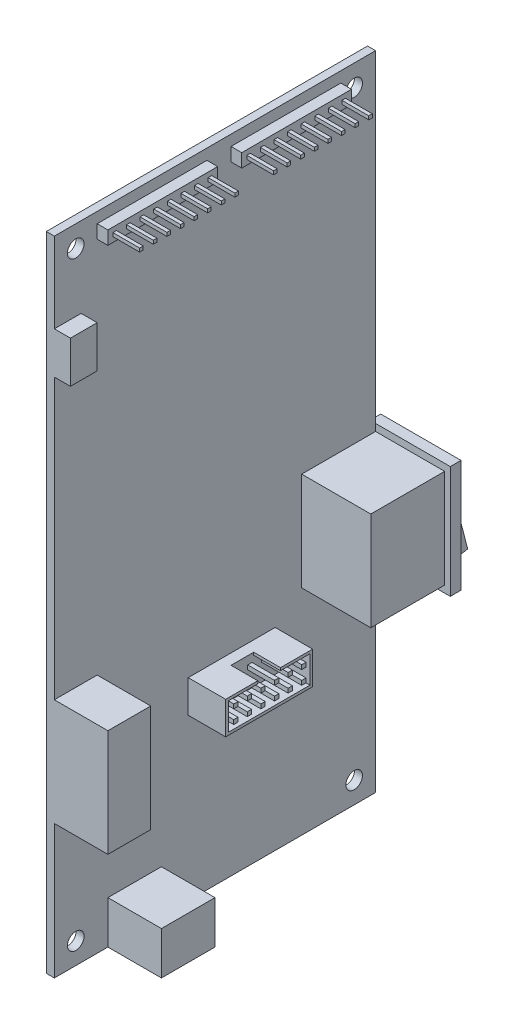
from build123d import *

# Parameters (mm, degrees)
SZKIC3_W                      = 60
SZKIC3_H                      = 120
DODANIE_WYCI_GNI_CIE1_DEPTH   = 1.5
SZKIC4_W                      = 20.5
SZKIC4_H                      = 2.5
DODANIE_WYCI_GNI_CIE2_DEPTH   = 2
SZKIC5_W                      = 0.66
SZKIC5_H                      = 0.66
DODANIE_WYCI_GNI_CIE3_DEPTH   = 5
SZYK_LINIOWY1_COUNT           = 8
SZYK_LINIOWY1_PITCH           = 2.54
SZKIC6_W                      = 16.24
SZKIC6_H                      = 6.08
DODANIE_WYCI_GNI_CIE4_DEPTH   = 2
SZKIC7_W                      = 0.8
SZKIC7_H                      = 0.8
DODANIE_WYCI_GNI_CIE5_DEPTH   = 5
SZYK_LINIOWY2_COUNT           = 6
SZYK_LINIOWY2_PITCH           = 2.54
SZYK_LINIOWY2_COUNT_DIR2      = 2
SZYK_LINIOWY2_PITCH_DIR2      = 2.54
DODANIE_WYCI_GNI_CIE6_DEPTH   = 5
SZKIC9_W                      = 10
SZKIC9_H                      = 8
DODANIE_WYCI_GNI_CIE7_DEPTH   = 10
SZKIC10_W                     = 8
SZKIC10_H                     = 20
DODANIE_WYCI_GNI_CIE8_DEPTH   = 10
SZKIC11_R                     = 1.55
WYTNIJ_WYCI_GNI_CIE2_DEPTH    = 10
SZYK_LINIOWY3_COUNT           = 2
SZYK_LINIOWY3_PITCH           = 52
SZYK_LINIOWY3_COUNT_DIR2      = 2
SZYK_LINIOWY3_PITCH_DIR2      = 112
SZKIC12_W                     = 5
SZKIC12_H                     = 7.8
DODANIE_WYCI_GNI_CIE9_DEPTH   = 3
DODANIE_WYCI_GNI_CIE11_DEPTH  = 12.9
SZYK_LINIOWY7_COUNT           = 2
SZYK_LINIOWY7_PITCH           = 25
SZYK_LINIOWY7_COPY_1_SKETCH_W = 0.66
SZYK_LINIOWY7_COPY_1_SKETCH_H = 0.66
SZYK_LINIOWY7_COPY_1_DEPTH    = 5
SZYK_LINIOWY7_COPY_2_SKETCH_W = 0.66
SZYK_LINIOWY7_COPY_2_SKETCH_H = 0.66
SZYK_LINIOWY7_COPY_2_DEPTH    = 5
SZYK_LINIOWY7_COPY_3_SKETCH_W = 0.66
SZYK_LINIOWY7_COPY_3_SKETCH_H = 0.66
SZYK_LINIOWY7_COPY_3_DEPTH    = 5
SZYK_LINIOWY7_COPY_4_SKETCH_W = 0.66
SZYK_LINIOWY7_COPY_4_SKETCH_H = 0.66
SZYK_LINIOWY7_COPY_4_DEPTH    = 5
SZYK_LINIOWY7_COPY_5_SKETCH_W = 0.66
SZYK_LINIOWY7_COPY_5_SKETCH_H = 0.66
SZYK_LINIOWY7_COPY_5_DEPTH    = 5
SZYK_LINIOWY7_COPY_6_SKETCH_W = 0.66
SZYK_LINIOWY7_COPY_6_SKETCH_H = 0.66
SZYK_LINIOWY7_COPY_6_DEPTH    = 5
SZYK_LINIOWY7_COPY_7_SKETCH_W = 0.66
SZYK_LINIOWY7_COPY_7_SKETCH_H = 0.66
SZYK_LINIOWY7_COPY_7_DEPTH    = 5
SZKIC14_W                     = 2
SZKIC14_H                     = 21
DODANIE_WYCI_GNI_CIE12_DEPTH  = 1.05
SZKIC15_W                     = 2
SZKIC15_H                     = 21
DODANIE_WYCI_GNI_CIE13_DEPTH  = 1.05
DODANIE_WYCI_GNI_CIE14_DEPTH  = 11.3
WYTNIJ_WYCI_GNI_CIE3_DEPTH    = 1.5


with BuildPart() as part:
    # Szkic3 → Dodanie-wyciągnięcie1 (new body)
    with BuildSketch(Plane.ZY.offset(-407.151296802)):
        with Locations((872.359296649, 154.240941848)):
            Rectangle(SZKIC3_W, SZKIC3_H)
    extrude(amount=DODANIE_WYCI_GNI_CIE1_DEPTH)

    # Szkic4 → Dodanie-wyciągnięcie2 (add)
    with BuildSketch(Plane(origin=(407.151296802, 0, 0), x_dir=(0, 0, -1), z_dir=(1, 0, 0))):
        with Locations((-884.109296649, 210.990941848)):
            Rectangle(SZKIC4_W, SZKIC4_H)
    dodanie_wyci_gni_cie2 = extrude(amount=DODANIE_WYCI_GNI_CIE2_DEPTH)

    # Szkic5 → Dodanie-wyciągnięcie3 (add)
    with BuildSketch(Plane(origin=(409.151296802, 0, 0), x_dir=(0, 0, -1), z_dir=(1, 0, 0))):
        with Locations((-893.089296649, 211.010941848)):
            Rectangle(SZKIC5_W, SZKIC5_H)
    dodanie_wyci_gni_cie3 = extrude(amount=DODANIE_WYCI_GNI_CIE3_DEPTH)

    # Szyk liniowy1: Dodanie-wyciągnięcie3 ×8
    with Locations(*[(0, 0, -i * SZYK_LINIOWY1_PITCH) for i in range(1, SZYK_LINIOWY1_COUNT)]):
        add(dodanie_wyci_gni_cie3)

    # Szkic6 → Dodanie-wyciągnięcie4 (add)
    with BuildSketch(Plane(origin=(407.151296802, 0, 0), x_dir=(0, 0, -1), z_dir=(1, 0, 0))):
        with Locations((-869.239296649, 127.280941848)):
            Rectangle(SZKIC6_W, SZKIC6_H)
    extrude(amount=DODANIE_WYCI_GNI_CIE4_DEPTH)

    # Szkic7 → Dodanie-wyciągnięcie5 (add)
    with BuildSketch(Plane(origin=(409.151296802, 0, 0), x_dir=(0, 0, -1), z_dir=(1, 0, 0))):
        with Locations((-875.459296649, 128.420941848)):
            Rectangle(SZKIC7_W, SZKIC7_H)
    dodanie_wyci_gni_cie5 = extrude(amount=DODANIE_WYCI_GNI_CIE5_DEPTH)

    # Szyk liniowy2: Dodanie-wyci_gni_cie5 6 × 2
    with Locations(*[(0, -j * SZYK_LINIOWY2_PITCH_DIR2, -i * SZYK_LINIOWY2_PITCH) for i in range(SZYK_LINIOWY2_COUNT) for j in range(SZYK_LINIOWY2_COUNT_DIR2) if (i, j) != (0, 0)]):
        add(dodanie_wyci_gni_cie5)

    # Szkic8 → Dodanie-wyciągnięcie6 (add)
    with BuildSketch(Plane(origin=(409.151296802, 0, 0), x_dir=(0, 0, -1), z_dir=(1, 0, 0))):
        Polygon((-876.859296649, 129.820941848), (-876.859296649, 124.740941848), (-861.619296649, 124.740941848), (-861.619296649, 129.820941848), (-867.119296649, 129.820941848), (-867.119296649, 130.320941848), (-861.119296649, 130.320941848), (-861.119296649, 124.240941848), (-877.359296649, 124.240941848), (-877.359296649, 130.320941848), (-871.359296649, 130.320941848), (-871.359296649, 129.820941848), align=None)
    extrude(amount=DODANIE_WYCI_GNI_CIE6_DEPTH)

    # Szkic9 → Dodanie-wyciągnięcie7 (add)
    with BuildSketch(Plane(origin=(407.151296802, 0, 0), x_dir=(0, 0, -1), z_dir=(1, 0, 0))):
        with Locations((-887.359296649, 98.240941848)):
            Rectangle(SZKIC9_W, SZKIC9_H)
    extrude(amount=DODANIE_WYCI_GNI_CIE7_DEPTH)

    # Szkic10 → Dodanie-wyciągnięcie8 (add)
    with BuildSketch(Plane(origin=(407.151296802, 0, 0), x_dir=(0, 0, -1), z_dir=(1, 0, 0))):
        with Locations((-898.359296649, 129.240941848)):
            Rectangle(SZKIC10_W, SZKIC10_H)
    extrude(amount=DODANIE_WYCI_GNI_CIE8_DEPTH)

    # Szkic11 → Wytnij-wyciągnięcie2 (cut)
    with BuildSketch(Plane(origin=(407.151296802, 0, 0), x_dir=(0, 0, -1), z_dir=(1, 0, 0))):
        with Locations((-898.359296649, 210.240941848)):
            Circle(SZKIC11_R)
    wytnij_wyci_gni_cie2 = extrude(amount=-WYTNIJ_WYCI_GNI_CIE2_DEPTH, mode=Mode.SUBTRACT)

    # Szyk liniowy3: Wytnij-wyci_gni_cie2 2 × 2
    with Locations(*[(0, -j * SZYK_LINIOWY3_PITCH_DIR2, -i * SZYK_LINIOWY3_PITCH) for i in range(SZYK_LINIOWY3_COUNT) for j in range(SZYK_LINIOWY3_COUNT_DIR2) if (i, j) != (0, 0)]):
        add(wytnij_wyci_gni_cie2, mode=Mode.SUBTRACT)

    # Szkic12 → Dodanie-wyciągnięcie9 (add)
    with BuildSketch(Plane(origin=(407.151296802, 0, 0), x_dir=(0, 0, -1), z_dir=(1, 0, 0))):
        with Locations((-899.859296649, 195.340941848)):
            Rectangle(SZKIC12_W, SZKIC12_H)
    extrude(amount=DODANIE_WYCI_GNI_CIE9_DEPTH)

    # Szyk liniowy7: Dodanie-wyciągnięcie2, Dodanie-wyciągnięcie3 ×2
    with Locations(*[(0, 0, -i * SZYK_LINIOWY7_PITCH) for i in range(1, SZYK_LINIOWY7_COUNT)]):
        add(dodanie_wyci_gni_cie2)
        add(dodanie_wyci_gni_cie3)

    # Szyk liniowy7 copy 1 sketch → Szyk liniowy7 copy 1 (add)
    with BuildSketch(Plane(origin=(409.151296802, 0, -27.54), x_dir=(0, 0, -1), z_dir=(1, 0, 0))):
        with Locations((-893.089296649, 211.010941848)):
            Rectangle(SZYK_LINIOWY7_COPY_1_SKETCH_W, SZYK_LINIOWY7_COPY_1_SKETCH_H)
    extrude(amount=SZYK_LINIOWY7_COPY_1_DEPTH)

    # Szyk liniowy7 copy 2 sketch → Szyk liniowy7 copy 2 (add)
    with BuildSketch(Plane(origin=(409.151296802, 0, -30.08), x_dir=(0, 0, -1), z_dir=(1, 0, 0))):
        with Locations((-893.089296649, 211.010941848)):
            Rectangle(SZYK_LINIOWY7_COPY_2_SKETCH_W, SZYK_LINIOWY7_COPY_2_SKETCH_H)
    extrude(amount=SZYK_LINIOWY7_COPY_2_DEPTH)

    # Szyk liniowy7 copy 3 sketch → Szyk liniowy7 copy 3 (add)
    with BuildSketch(Plane(origin=(409.151296802, 0, -32.62), x_dir=(0, 0, -1), z_dir=(1, 0, 0))):
        with Locations((-893.089296649, 211.010941848)):
            Rectangle(SZYK_LINIOWY7_COPY_3_SKETCH_W, SZYK_LINIOWY7_COPY_3_SKETCH_H)
    extrude(amount=SZYK_LINIOWY7_COPY_3_DEPTH)

    # Szyk liniowy7 copy 4 sketch → Szyk liniowy7 copy 4 (add)
    with BuildSketch(Plane(origin=(409.151296802, 0, -35.16), x_dir=(0, 0, -1), z_dir=(1, 0, 0))):
        with Locations((-893.089296649, 211.010941848)):
            Rectangle(SZYK_LINIOWY7_COPY_4_SKETCH_W, SZYK_LINIOWY7_COPY_4_SKETCH_H)
    extrude(amount=SZYK_LINIOWY7_COPY_4_DEPTH)

    # Szyk liniowy7 copy 5 sketch → Szyk liniowy7 copy 5 (add)
    with BuildSketch(Plane(origin=(409.151296802, 0, -37.7), x_dir=(0, 0, -1), z_dir=(1, 0, 0))):
        with Locations((-893.089296649, 211.010941848)):
            Rectangle(SZYK_LINIOWY7_COPY_5_SKETCH_W, SZYK_LINIOWY7_COPY_5_SKETCH_H)
    extrude(amount=SZYK_LINIOWY7_COPY_5_DEPTH)

    # Szyk liniowy7 copy 6 sketch → Szyk liniowy7 copy 6 (add)
    with BuildSketch(Plane(origin=(409.151296802, 0, -40.24), x_dir=(0, 0, -1), z_dir=(1, 0, 0))):
        with Locations((-893.089296649, 211.010941848)):
            Rectangle(SZYK_LINIOWY7_COPY_6_SKETCH_W, SZYK_LINIOWY7_COPY_6_SKETCH_H)
    extrude(amount=SZYK_LINIOWY7_COPY_6_DEPTH)

    # Szyk liniowy7 copy 7 sketch → Szyk liniowy7 copy 7 (add)
    with BuildSketch(Plane(origin=(409.151296802, 0, -42.78), x_dir=(0, 0, -1), z_dir=(1, 0, 0))):
        with Locations((-893.089296649, 211.010941848)):
            Rectangle(SZYK_LINIOWY7_COPY_7_SKETCH_W, SZYK_LINIOWY7_COPY_7_SKETCH_H)
    extrude(amount=SZYK_LINIOWY7_COPY_7_DEPTH)



with BuildPart() as body_2:
    # Szkic13 → Dodanie-wyciągnięcie11 (new body)
    with BuildSketch(Plane(origin=(407.151296802, 0, 0), x_dir=(0, 0, -1), z_dir=(1, 0, 0))):
        Polygon((-856.159296649, 152.640941848), (-856.159296649, 134.240941848), (-842.359296649, 134.240941848), (-842.359296649, 132.940941848), (-840.359296649, 132.940941848), (-840.359296649, 153.940941848), (-842.359296649, 153.940941848), (-842.359296649, 152.640941848), align=None)
    extrude(amount=DODANIE_WYCI_GNI_CIE11_DEPTH)

    # Szkic14 → Dodanie-wyciągnięcie12 (add)
    with BuildSketch(Plane(origin=(420.051296802, 0, 0), x_dir=(0, 0, -1), z_dir=(1, 0, 0))):
        with Locations((-841.359296649, 143.440941848)):
            Rectangle(SZKIC14_W, SZKIC14_H)
    extrude(amount=DODANIE_WYCI_GNI_CIE12_DEPTH)


with BuildPart() as part_1:
    add(part.part)

    add(body_2.part)  # Dodanie-wyciągnięcie13 merges body 2
    # Szkic15 → Dodanie-wyciągnięcie13 (add)
    with BuildSketch(Plane.ZY.offset(-407.151296802)):
        with Locations((841.359296649, 143.440941848)):
            Rectangle(SZKIC15_W, SZKIC15_H)
    extrude(amount=DODANIE_WYCI_GNI_CIE13_DEPTH)


with BuildPart() as body_2_2:
    # Szkic16 → Dodanie-wyciągnięcie14 (new body)
    with BuildSketch(Plane(origin=(420.051296802, 0, 0), x_dir=(0, 0, -1), z_dir=(1, 0, 0))):
        Polygon((-840.359296649, 151.140941848), (-840.359296649, 135.740941848), (-836.559296649, 136.440941848), align=None)
    extrude(amount=-DODANIE_WYCI_GNI_CIE14_DEPTH)

    # Szkic17 → Wytnij-wyciągnięcie3 (cut)
    with BuildSketch(Plane(origin=(420.051296802, 0, 0), x_dir=(0, 0, -1), z_dir=(1, 0, 0))):
        Polygon((-836.559296649, 136.440941848), (-840.359296649, 151.140941848), (-840.359296649, 135.740941848), align=None)
    extrude(amount=-WYTNIJ_WYCI_GNI_CIE3_DEPTH, mode=Mode.SUBTRACT)


solid = Compound([part_1.part, body_2_2.part])
